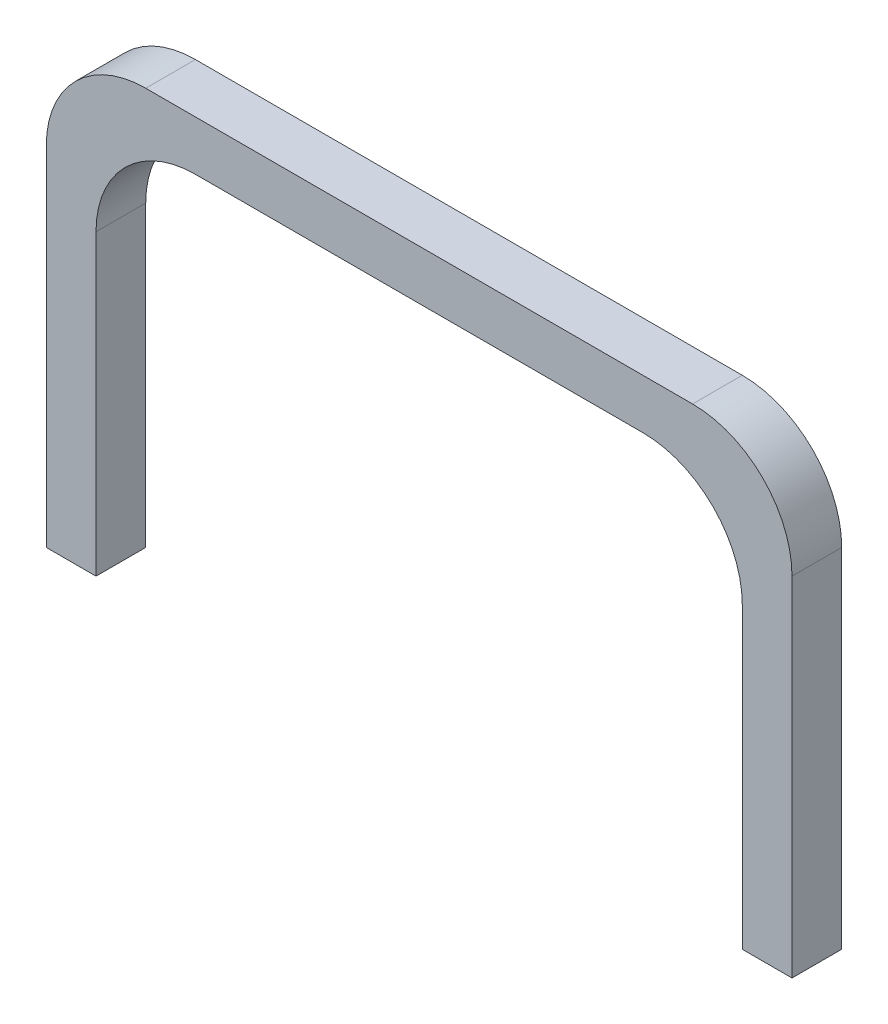
from build123d import *

# Parameters (mm, degrees)
SKETCH_1_W      = 15
SKETCH_1_H      = 1
EXTRUDE_1_DEPTH = 0.5
SKETCH_2_W      = 1
SKETCH_2_H      = 1
EXTRUDE_2_DEPTH = 8
FILLET_1_R      = 2


with BuildPart() as part:
    # Эскиз1 → Бобышка-Вытянуть1 (new, symmetric)
    with BuildSketch(Plane(origin=(0, 0, 0), x_dir=(1, 0, 0), z_dir=(0, 1, 0))):
        Rectangle(SKETCH_1_W, SKETCH_1_H)
    extrude(amount=EXTRUDE_1_DEPTH, both=True)

    # Эскиз2 → Бобышка-Вытянуть2 (add)
    with BuildSketch(Plane.XZ.offset(0.5)):
        with Locations((-7, 0)):
            Rectangle(SKETCH_2_W, SKETCH_2_H)
        with Locations((7, 0)):
            Rectangle(SKETCH_2_W, SKETCH_2_H)
    extrude(amount=EXTRUDE_2_DEPTH)

    # Скругление1
    fillet_1_edges = [part.edges().sort_by_distance(p)[0] for p in [
        (-7.5, 0.5, 0),
        (-6.5, -0.5, 0),
        (6.5, -0.5, 0),
        (7.5, 0.5, 0),
    ]]
    fillet(fillet_1_edges, radius=FILLET_1_R)


solid = part.part
